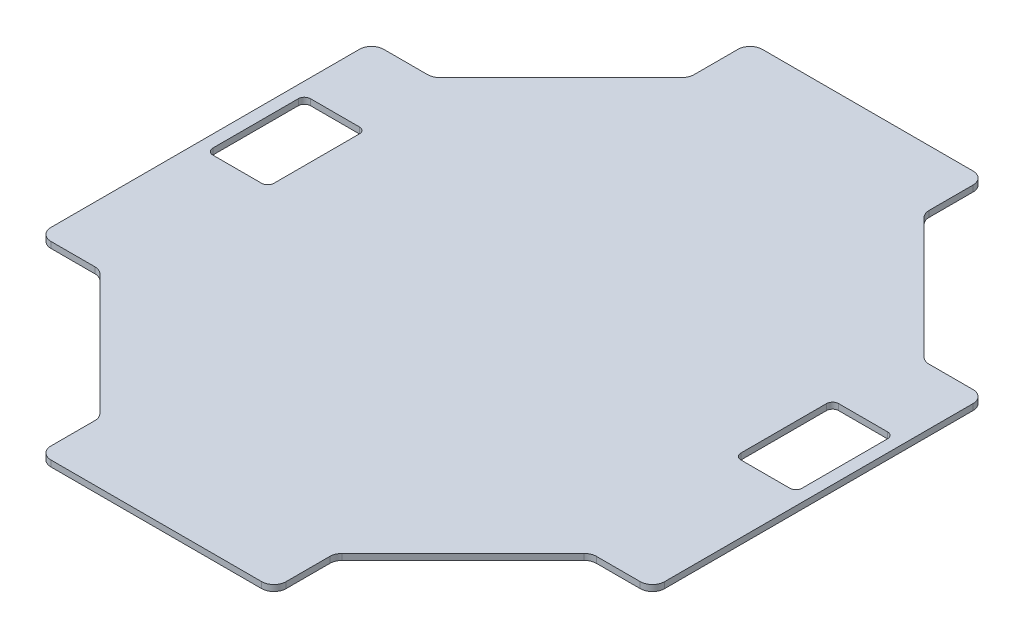
from build123d import *

# Parameters (mm, degrees)
BOSS_EXTRUDE1_DEPTH = 6.35


with BuildPart() as part:
    # Sketch1 → Boss-Extrude1 (new body)
    with BuildSketch(Plane(origin=(0, 0, 0), x_dir=(1, 0, 0), z_dir=(0, 1, 0))):
        with BuildLine():
            Line((209.55, 0), (428.625, 0))
            ThreePointArc((428.625, 0), (437.605256121, 3.719743879), (441.325, 12.7))
            Line((441.325, 12.7), (441.325, 58.239487758))
            ThreePointArc((441.325, 58.239487758), (442.291729937, 63.099567349), (445.044743879, 67.219743879))
            Line((445.044743879, 67.219743879), (570.955256121, 193.130256121))
            ThreePointArc((570.955256121, 193.130256121), (575.075432651, 195.883270063), (579.935512242, 196.85))
            Line((579.935512242, 196.85), (625.475, 196.85))
            ThreePointArc((625.475, 196.85), (634.455256121, 200.569743879), (638.175, 209.55))
            Line((638.175, 209.55), (638.175, 358.775))
            Line((638.175, 358.775), (638.175, 460.375))
            Line((638.175, 460.375), (638.175, 530.225))
            ThreePointArc((638.175, 530.225), (634.455256121, 539.205256121), (625.475, 542.925))
            Line((625.475, 542.925), (579.935512242, 542.925))
            ThreePointArc((579.935512242, 542.925), (575.075432651, 543.891729937), (570.955256121, 546.644743879))
            Line((570.955256121, 546.644743879), (445.044743879, 672.555256121))
            ThreePointArc((445.044743879, 672.555256121), (442.291729937, 676.675432651), (441.325, 681.535512242))
            Line((441.325, 681.535512242), (441.325, 727.075))
            ThreePointArc((441.325, 727.075), (437.605256121, 736.055256121), (428.625, 739.775))
            Line((428.625, 739.775), (209.55, 739.775))
            ThreePointArc((209.55, 739.775), (200.569743879, 736.055256121), (196.85, 727.075))
            Line((196.85, 727.075), (196.85, 681.535512242))
            ThreePointArc((196.85, 681.535512242), (195.883270063, 676.675432651), (193.130256121, 672.555256121))
            Line((193.130256121, 672.555256121), (67.219743879, 546.644743879))
            ThreePointArc((67.219743879, 546.644743879), (63.099567349, 543.891729937), (58.239487758, 542.925))
            Line((58.239487758, 542.925), (12.7, 542.925))
            ThreePointArc((12.7, 542.925), (3.719743879, 539.205256121), (0, 530.225))
            Line((0, 530.225), (0, 209.55))
            ThreePointArc((0, 209.55), (3.719743879, 200.569743879), (12.7, 196.85))
            Line((12.7, 196.85), (58.239487758, 196.85))
            ThreePointArc((58.239487758, 196.85), (63.099567349, 195.883270063), (67.219743879, 193.130256121))
            Line((67.219743879, 193.130256121), (193.130256121, 67.219743879))
            ThreePointArc((193.130256121, 67.219743879), (195.883270063, 63.099567349), (196.85, 58.239487758))
            Line((196.85, 58.239487758), (196.85, 12.7))
            ThreePointArc((196.85, 12.7), (200.569743879, 3.719743879), (209.55, 0))
        make_face()
        with BuildLine():
            Line((619.125, 460.375), (568.325, 460.375))
            ThreePointArc((568.325, 460.375), (563.834871939, 458.515128061), (561.975, 454.025))
            Line((561.975, 454.025), (561.975, 365.125))
            ThreePointArc((561.975, 365.125), (563.834871939, 360.634871939), (568.325, 358.775))
            Line((568.325, 358.775), (619.125, 358.775))
            ThreePointArc((619.125, 358.775), (623.615128061, 360.634871939), (625.475, 365.125))
            Line((625.475, 365.125), (625.475, 454.025))
            ThreePointArc((625.475, 454.025), (623.615128061, 458.515128061), (619.125, 460.375))
        make_face(mode=Mode.SUBTRACT)
        with BuildLine():
            Line((12.7, 454.025), (12.7, 365.125))
            ThreePointArc((12.7, 365.125), (14.559871939, 360.634871939), (19.05, 358.775))
            Line((19.05, 358.775), (69.85, 358.775))
            ThreePointArc((69.85, 358.775), (74.340128061, 360.634871939), (76.2, 365.125))
            Line((76.2, 365.125), (76.2, 454.025))
            ThreePointArc((76.2, 454.025), (74.340128061, 458.515128061), (69.85, 460.375))
            Line((69.85, 460.375), (19.05, 460.375))
            ThreePointArc((19.05, 460.375), (14.559871939, 458.515128061), (12.7, 454.025))
        make_face(mode=Mode.SUBTRACT)
    extrude(amount=BOSS_EXTRUDE1_DEPTH)


solid = part.part
